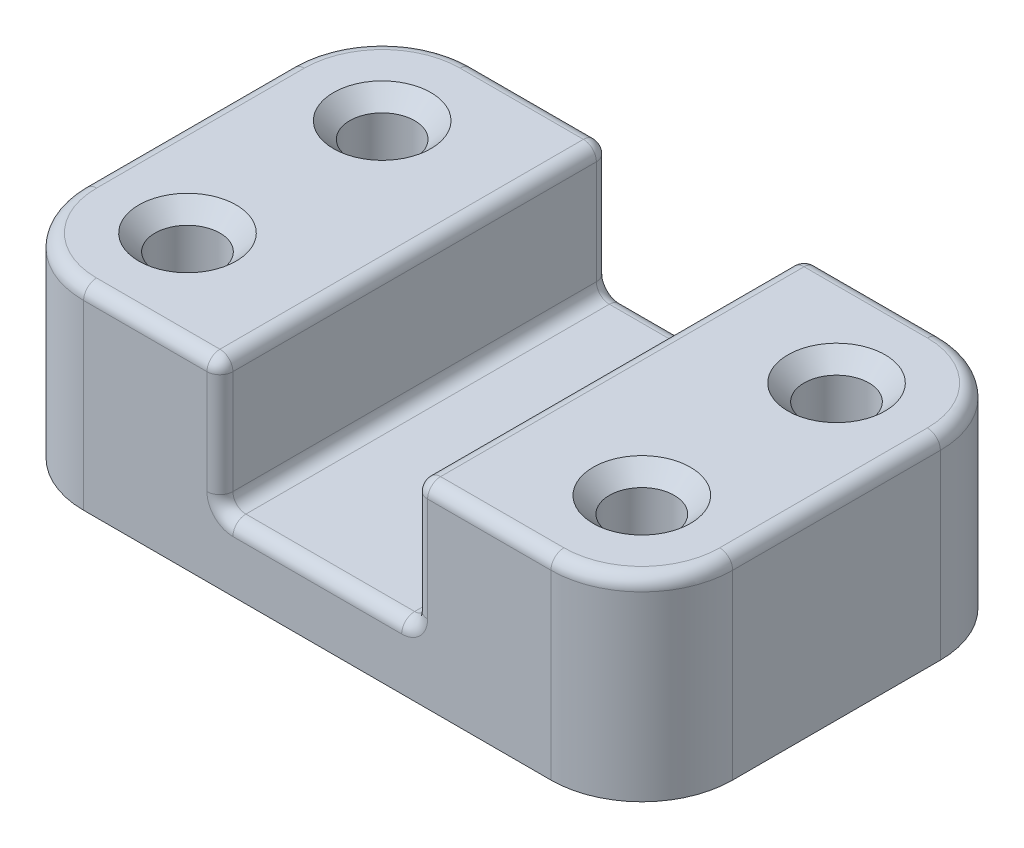
from build123d import *

# Parameters (mm, degrees)
SKETCH1_W           = 127
SKETCH1_H           = 76.2
BOSS_EXTRUDE1_DEPTH = 38.1
SKETCH2_R           = 6.35
CUT_EXTRUDE2_DEPTH  = 84.279469259
SKETCH3_W           = 38.1
SKETCH3_H           = 76.2
CUT_EXTRUDE3_DEPTH  = 25.4
FILLET1_R           = 17.78
CHAMFER1_SIZE       = 3.175
SHELL1_T            = -2.54
FILLET2_R           = 2.54


with BuildPart() as part:
    # Sketch1 → Boss-Extrude1 (new body)
    with BuildSketch(Plane(origin=(0, 0, 0), x_dir=(1, 0, 0), z_dir=(0, 1, 0))):
        Rectangle(SKETCH1_W, SKETCH1_H)
    extrude(amount=BOSS_EXTRUDE1_DEPTH)

    # Sketch2 → Cut-Extrude2 (cut, through all)
    with BuildSketch(Plane(origin=(0, 38.1, 0), x_dir=(1, 0, 0), z_dir=(0, 1, 0))):
        with Locations(Location((-44.45, 19.05, 0), (0, 0, 270))):
            Circle(SKETCH2_R)
        with Locations(Location((44.45, 19.05, 0), (0, 0, 270))):
            Circle(SKETCH2_R)
        with Locations(Location((44.45, -19.05, 0), (0, 0, 270))):
            Circle(SKETCH2_R)
        with Locations(Location((-44.45, -19.05, 0), (0, 0, 270))):
            Circle(SKETCH2_R)
    extrude(amount=-CUT_EXTRUDE2_DEPTH, mode=Mode.SUBTRACT)

    # Sketch3 → Cut-Extrude3 (cut)
    with BuildSketch(Plane(origin=(0, 38.1, 0), x_dir=(1, 0, 0), z_dir=(0, 1, 0))):
        Rectangle(SKETCH3_W, SKETCH3_H)
    extrude(amount=-CUT_EXTRUDE3_DEPTH, mode=Mode.SUBTRACT)

    # Fillet1
    fillet1_edges = [part.edges().sort_by_distance(p)[0] for p in [
        (63.5, 19.05, 38.1),
        (-63.5, 19.05, 38.1),
        (-63.5, 19.05, -38.1),
        (63.5, 19.05, -38.1),
    ]]
    fillet(fillet1_edges, radius=FILLET1_R)

    # Chamfer1
    chamfer1_edges = [part.edges().sort_by_distance(p)[0] for p in [
        (-44.45, 38.1, 12.7),
        (44.45, 38.1, 12.7),
        (44.45, 38.1, -25.4),
        (-44.45, 38.1, -25.4),
    ]]
    chamfer(chamfer1_edges, length=CHAMFER1_SIZE)

    # Shell1
    shell1_openings = [part.faces().sort_by_distance(p)[0] for p in [
        (0, 0, 0),
    ]]
    offset(amount=SHELL1_T, openings=shell1_openings, kind=Kind.INTERSECTION)

    # Fillet2
    fillet2_edges = [part.edges().sort_by_distance(p)[0] for p in [
        (-32.385, 38.1, -38.1),
        (32.385, 38.1, 38.1),
        (19.05, 12.7, 0),
        (19.05, 25.4, -38.1),
        (0, 12.7, 38.1),
        (19.05, 25.4, 38.1),
        (-19.05, 12.7, 0),
        (-19.05, 25.4, 38.1),
        (0, 12.7, -38.1),
        (-19.05, 25.4, -38.1),
        (19.05, 38.1, 0),
        (-19.05, 38.1, 0),
        (-63.5, 38.1, 0),
        (32.385, 38.1, -38.1),
        (-32.385, 38.1, 38.1),
        (-58.292358569, 38.1, 32.892358569),
        (-58.292358569, 38.1, -32.892358569),
        (63.5, 38.1, 0),
        (58.292358569, 38.1, 32.892358569),
        (58.292358569, 38.1, -32.892358569),
    ]]
    fillet(fillet2_edges, radius=FILLET2_R)


solid = part.part
